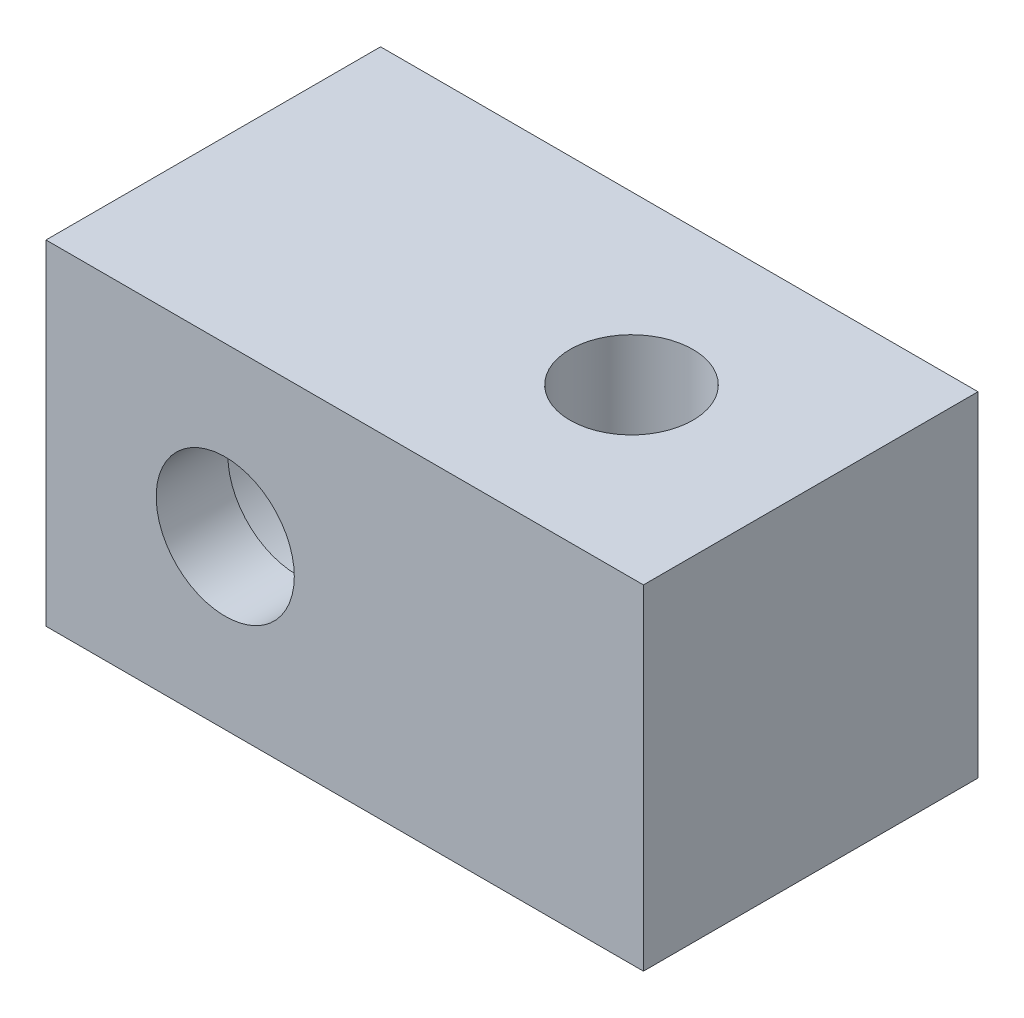
from build123d import *

# Parameters (mm, degrees)
SKETCH1_W               = 31.75
SKETCH1_H               = 17.78
BOSS_EXTRUDE1_DEPTH     = 17.78
SKETCH3_R               = 6.4389
CUT_EXTRUDE1_DEPTH      = 13.97
CUT_EXTRUDE2_REACH      = 31.737
SKETCH2_R               = 3.6703
F_1_4_CLEARANCE_HOLE1_D = 6.5278


with BuildPart() as part:
    # Sketch1 → Boss-Extrude1 (new body)
    with BuildSketch(Plane(origin=(0, 0, 0), x_dir=(1, 0, 0), z_dir=(0, 1, 0))):
        Rectangle(SKETCH1_W, SKETCH1_H)
    extrude(amount=BOSS_EXTRUDE1_DEPTH)

    # Sketch3 → Cut-Extrude1 (cut)
    with BuildSketch(Plane(origin=(0, 0, -8.89), x_dir=(-1, 0, 0), z_dir=(0, 0, -1))):
        with Locations((6.35, 8.89)):
            Circle(SKETCH3_R)
    extrude(amount=-CUT_EXTRUDE1_DEPTH, mode=Mode.SUBTRACT)

    # Sketch2 → Cut-Extrude2 (cut, up to next)
    with BuildSketch(Plane.XY.offset(8.89), mode=Mode.PRIVATE) as cut_extrude2_sk1:
        with Locations((-6.35, 8.89)):
            Circle(SKETCH2_R)
    cut_extrude2_tool1 = extrude(cut_extrude2_sk1.sketch, amount=-CUT_EXTRUDE2_REACH, mode=Mode.PRIVATE) & part.part
    add(cut_extrude2_tool1.solids().sort_by_distance((-6.35, 8.89, 8.89))[0], mode=Mode.SUBTRACT)

    # 1/4 Clearance Hole1 (through all)
    with Locations(Plane(origin=(0, 17.78, 0), x_dir=(1, 0, 0), z_dir=(0, 1, 0))):
        with Locations((6.35, 0)):
            Hole(F_1_4_CLEARANCE_HOLE1_D / 2)


solid = part.part
